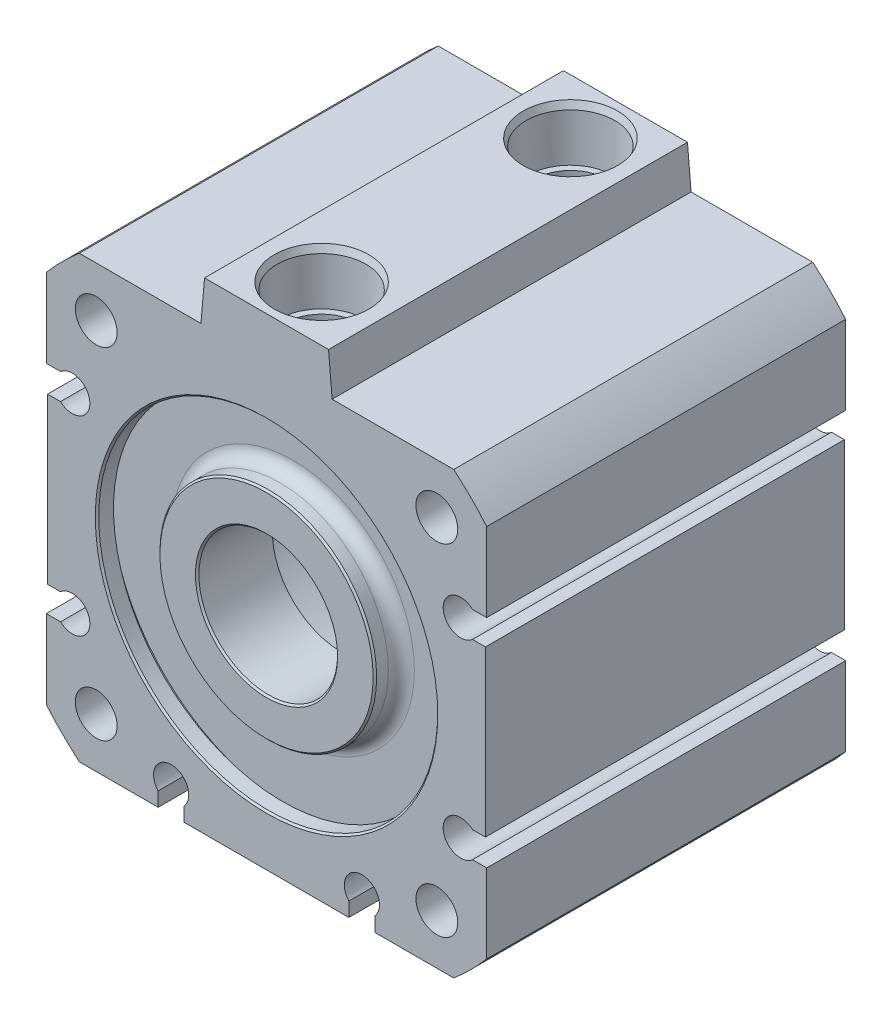
from build123d import *

# Parameters (mm, degrees)
EXTRUDE1_DEPTH                               = 20.701
EXTRUDE1_DEPTH_BACK                          = 20.701
SKETCH1_W                                    = 50.8
SKETCH1_H                                    = 50.8
F_056_250_NOSE_CHAMFER_R                     = 1.5
SKETCH13_R                                   = 35.921024484
SKETCH13_R_2                                 = 33.34
F_075_250_TUBE_EDGE_ROUNDOVER_DEPTH          = 55.812823354
F_075_250_PORT_BOSS_DEPTH                    = 41.402
F_106_200_PORT_1_8_NPT_AT_2_COUNT            = 2
F_106_200_PORT_1_8_NPT_AT_2_PITCH            = 28.702
F_075_250_SWITCH_GROOVE_DEPTH                = 58.174392905
F_075_106_SWITCH_GROOVE_CIRC_PATTERN_COUNT   = 3
F_075_106_SWITCH_GROOVE_CIRC_PATTERN_ANGLE   = 180
SKETCH19_W                                   = 0.15
SKETCH19_H                                   = 19
F_075_250_THIN_SIDE_CUTS_DEPTH               = 58.174392905
SKETCH20_R                                   = 1.9
F_075_250_MOUNT_THRU_HOLE_DEPTH              = 58.174392905
F_075_250_MOUNT_THRU_HOLE_CIRC_PATTERN_COUNT = 4
F_150_10_24_A_MOUNT_TAPPED_AT_2_COUNT        = 2
F_150_10_24_A_MOUNT_TAPPED_AT_2_PITCH        = 39.29
F_150_10_24_A_MOUNT_TAPPED_AT_3_COUNT        = 2
F_150_10_24_A_MOUNT_TAPPED_AT_3_PITCH        = 55.564450866
F_150_10_24_A_MOUNT_TAPPED_AT_4_COUNT        = 2
F_150_10_24_A_MOUNT_TAPPED_AT_4_PITCH        = 39.29
F_056_250_START                              = -12.025
SKETCH22_R                                   = 19.05
F_056_250_STROKE_CHAMBER_DEPTH               = 24.05
SKETCH23_R                                   = 8.001
F_056_250_ROD_THRU_BORE_DEPTH                = 45.534447353
SKETCH41_R                                   = 19.05
SKETCH41_R_2                                 = 18.55
END_PLATE_DEPTH                              = 1
END_PLATE_TAPER                              = 30
F_056_250_COLLAR_CHAMFER_SIZE                = 0.2


with BuildPart() as part:
    # Sketch1 → Extrude1 (new, two sides: drawn at the far end of the back side and taken through both)
    with BuildSketch(Plane.XY.offset(-EXTRUDE1_DEPTH_BACK)):
        Rectangle(SKETCH1_W, SKETCH1_H)
    extrude(amount=EXTRUDE1_DEPTH + EXTRUDE1_DEPTH_BACK)

    # Sketch33 → 056-250 Front Recess (revolve, cut)
    with BuildSketch(Plane(origin=(0, 0, 0), x_dir=(0, 0, -1), z_dir=(1, 0, 0)), mode=Mode.PRIVATE) as f_056_250_front_recess_sk:
        Polygon((-20.701, 19.55), (-18.801, 19.55), (-18.801, 21), (-17.651, 21), (-17.651, 12.5), (-20.701, 12.5), align=None)
    revolve(f_056_250_front_recess_sk.sketch.rotate(Axis((0, 0, 61.220394237), (0, 0, -1)), 90), axis=Axis((0, 0, 61.220394237), (0, 0, -1)), mode=Mode.SUBTRACT)

    # 056-250 Nose Chamfer
    f_056_250_nose_chamfer_edges = [part.edges().sort_by_distance(p)[0] for p in [
        (-12.5, 0, 17.651),
    ]]
    fillet(f_056_250_nose_chamfer_edges, radius=F_056_250_NOSE_CHAMFER_R)

    # Sketch13 → 075-250 Tube Edge Roundover (cut, through all)
    with BuildSketch(Plane.XY.offset(20.701)):
        Circle(SKETCH13_R)
        Circle(SKETCH13_R_2, mode=Mode.SUBTRACT)
    extrude(amount=-F_075_250_TUBE_EDGE_ROUNDOVER_DEPTH, mode=Mode.SUBTRACT)

    # Sketch14 → 075-250 Port Boss (add)
    with BuildSketch(Plane.XY.offset(20.701)):
        Polygon((-7.15, 30.16), (7.15, 30.16), (7.566446038, 25.4), (-7.566446038, 25.4), align=None)
    extrude(amount=-F_075_250_PORT_BOSS_DEPTH)

    # Sketch36 → 106-200 Port 1/8 NPT (revolve, cut)
    with BuildSketch(Plane(origin=(0, 30.16, 14.351), x_dir=(0, 0, 1), z_dir=(1, 0, 0))):
        Polygon((0, 0), (0, 10.533468714), (4.2164, 8), (4.2164, 6.2), (4.959907269, 6.2), (5.1218211, 0.792298297), (5.4500018, 0), align=None)
    f_106_200_port_1_8_npt = revolve(axis=Axis((0, 36.51, 14.351), (0, -1, 0)), mode=Mode.SUBTRACT)

    # 106-200 Port 1/8 NPT at 2: 106-200 Port 1/8 NPT ×2
    with Locations(*[(0, 0, -i * F_106_200_PORT_1_8_NPT_AT_2_PITCH) for i in range(1, F_106_200_PORT_1_8_NPT_AT_2_COUNT)]):
        add(f_106_200_port_1_8_npt, mode=Mode.SUBTRACT)

    # Sketch15 → 075-250 Switch Groove (cut, through all)
    with BuildSketch(Plane.XY.offset(20.701)):
        with BuildLine():
            Line((-25.4, 12.5), (-23.760376786, 12.5))
            ThreePointArc((-23.760376786, 12.5), (-20.375, 11), (-23.760376786, 9.5))
            Line((-23.760376786, 9.5), (-25.4, 9.5))
            Line((-25.4, 9.5), (-25.4, 12.5))
        make_face()
        with BuildLine():
            Line((-25.4, -12.5), (-25.4, -9.5))
            Line((-25.4, -9.5), (-23.760376786, -9.5))
            ThreePointArc((-23.760376786, -9.5), (-20.375, -11), (-23.760376786, -12.5))
            Line((-23.760376786, -12.5), (-25.4, -12.5))
        make_face()
    f_075_250_switch_groove = extrude(amount=-F_075_250_SWITCH_GROOVE_DEPTH, mode=Mode.SUBTRACT)

    # 075-106 Switch Groove Circ Pattern: 075-250 Switch Groove ×3 about axis
    f_075_106_switch_groove_circ_pattern_axis = Axis((0, 0, 0), (0, 0, 1))
    for i in range(1, F_075_106_SWITCH_GROOVE_CIRC_PATTERN_COUNT):
        add(f_075_250_switch_groove.rotate(f_075_106_switch_groove_circ_pattern_axis, i * F_075_106_SWITCH_GROOVE_CIRC_PATTERN_ANGLE / (F_075_106_SWITCH_GROOVE_CIRC_PATTERN_COUNT - 1)), mode=Mode.SUBTRACT)

    # Sketch19 → 075-250 Thin Side Cuts (cut, through all)
    with BuildSketch(Plane.XY.offset(20.701)):
        with Locations((25.325, 0)):
            Rectangle(SKETCH19_W, SKETCH19_H)
        with Locations((-25.325, 0)):
            Rectangle(SKETCH19_W, SKETCH19_H)
    extrude(amount=-F_075_250_THIN_SIDE_CUTS_DEPTH, mode=Mode.SUBTRACT)

    # Sketch20 → 075-250 Mount Thru Hole (cut, through all)
    with BuildSketch(Plane.XY.offset(20.701)):
        with Locations((19.645, 19.645)):
            Circle(SKETCH20_R)
    f_075_250_mount_thru_hole = extrude(amount=-F_075_250_MOUNT_THRU_HOLE_DEPTH, mode=Mode.SUBTRACT)

    # 075-250 Mount Thru Hole Circ Pattern: 075-250 Mount Thru Hole ×4 about axis
    f_075_250_mount_thru_hole_circ_pattern_axis = Axis((0, 0, 0), (0, 0, 1))
    for i in range(1, F_075_250_MOUNT_THRU_HOLE_CIRC_PATTERN_COUNT):
        add(f_075_250_mount_thru_hole.rotate(f_075_250_mount_thru_hole_circ_pattern_axis, i * 360 / F_075_250_MOUNT_THRU_HOLE_CIRC_PATTERN_COUNT), mode=Mode.SUBTRACT)

    # Sketch28 → 150 #10-24 A Mount Tapped (revolve, cut)
    with BuildSketch(Plane(origin=(19.645, 19.645, 20.701), x_dir=(0, -1, 0), z_dir=(1, 0, 0))):
        Polygon((0, 0), (0, 17.018324014), (1.89865, 15.8775), (1.89865, 12.7), (2.413, 12.7), (2.413, 0), align=None)
    f_150_10_24_a_mount_tapped = revolve(axis=Axis((19.645, 19.645, 27.051), (0, 0, -1)), mode=Mode.SUBTRACT)

    # 150 #10-24 A Mount Tapped at 2: 150 #10-24 A Mount Tapped ×2
    with Locations(*[(-i * F_150_10_24_A_MOUNT_TAPPED_AT_2_PITCH, 0, 0) for i in range(1, F_150_10_24_A_MOUNT_TAPPED_AT_2_COUNT)]):
        add(f_150_10_24_a_mount_tapped, mode=Mode.SUBTRACT)

    # 150 #10-24 A Mount Tapped at 3: 150 #10-24 A Mount Tapped ×2
    with Locations(*[Vector(-0.7071067811865451, -0.7071067811865499, 0) * (i * F_150_10_24_A_MOUNT_TAPPED_AT_3_PITCH) for i in range(1, F_150_10_24_A_MOUNT_TAPPED_AT_3_COUNT)]):
        add(f_150_10_24_a_mount_tapped, mode=Mode.SUBTRACT)

    # 150 #10-24 A Mount Tapped at 4: 150 #10-24 A Mount Tapped ×2
    with Locations(*[(0, -i * F_150_10_24_A_MOUNT_TAPPED_AT_4_PITCH, 0) for i in range(1, F_150_10_24_A_MOUNT_TAPPED_AT_4_COUNT)]):
        add(f_150_10_24_a_mount_tapped, mode=Mode.SUBTRACT)

    # 150 #10-24 A Mount Tapped to Rear: 150 #10-24 A Mount Tapped across plane
    add(f_150_10_24_a_mount_tapped.mirror(Plane.XY), mode=Mode.SUBTRACT)

    # 150 #10-24 A Mount Tapped to Rear copy 1 → 150 #10-24 A Mount Tapped to Rear co 2 (revolve, cut)
    with BuildSketch(Plane(origin=(-19.645, 19.645, -20.701), x_dir=(0, -1, 0), z_dir=(1, 0, 0))):
        Polygon((0, 0), (0, -17.018324014), (1.89865, -15.8775), (1.89865, -12.7), (2.413, -12.7), (2.413, 0), align=None)
    revolve(axis=Axis((-19.645, 19.645, -27.051), (0, 0, -1)), mode=Mode.SUBTRACT)

    # 150 #10-24 A Mount Tapped to Rear copy 2 → 150 #10-24 A Mount Tapped to Rear co 3 (revolve, cut)
    with BuildSketch(Plane(origin=(-19.645, -19.645, -20.701), x_dir=(0, -1, 0), z_dir=(1, 0, 0))):
        Polygon((0, 0), (0, -17.018324014), (1.89865, -15.8775), (1.89865, -12.7), (2.413, -12.7), (2.413, 0), align=None)
    revolve(axis=Axis((-19.645, -19.645, -27.051), (0, 0, -1)), mode=Mode.SUBTRACT)

    # 150 #10-24 A Mount Tapped to Rear copy 3 → 150 #10-24 A Mount Tapped to Rear co 4 (revolve, cut)
    with BuildSketch(Plane(origin=(19.645, -19.645, -20.701), x_dir=(0, -1, 0), z_dir=(1, 0, 0))):
        Polygon((0, 0), (0, -17.018324014), (1.89865, -15.8775), (1.89865, -12.7), (2.413, -12.7), (2.413, 0), align=None)
    revolve(axis=Axis((19.645, -19.645, -27.051), (0, 0, -1)), mode=Mode.SUBTRACT)

    # Sketch22 → 056-250 Stroke Chamber (cut)
    with BuildSketch(Plane.XY.offset(F_056_250_START)):
        Circle(SKETCH22_R)
    extrude(amount=F_056_250_STROKE_CHAMBER_DEPTH, mode=Mode.SUBTRACT)

    # Sketch23 → 056-250 Rod Thru Bore (cut, through all)
    with BuildSketch(Plane.XY):
        Circle(SKETCH23_R)
    extrude(amount=F_056_250_ROD_THRU_BORE_DEPTH, mode=Mode.SUBTRACT)

    # Sketch41 → End Plate (cut)
    with BuildSketch(Plane(origin=(0, 0, -20.701), x_dir=(-1, 0, 0), z_dir=(0, 0, -1))):
        with Locations(Location((0, 0, 0), (0, 0, 180))):
            Circle(SKETCH41_R)
        Circle(SKETCH41_R_2, mode=Mode.SUBTRACT)
    extrude(amount=-END_PLATE_DEPTH, taper=END_PLATE_TAPER, mode=Mode.SUBTRACT)

    # 056-250 Collar Chamfer
    f_056_250_collar_chamfer_edges = [part.edges().sort_by_distance(p)[0] for p in [
        (-19.55, 0, 20.701),
        (-12.5, 0, 20.701),
        (-8.001, 0, 20.701),
    ]]
    chamfer(f_056_250_collar_chamfer_edges, length=F_056_250_COLLAR_CHAMFER_SIZE)


solid = part.part
